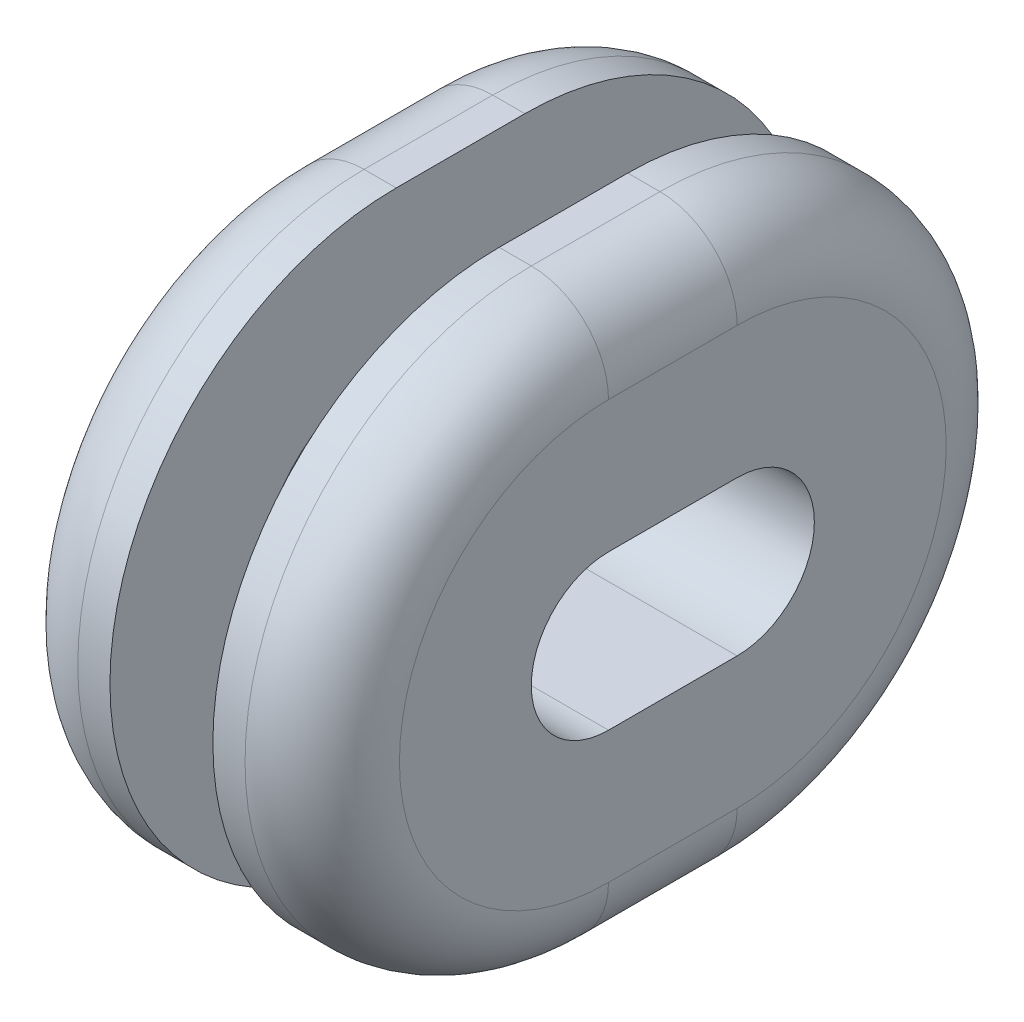
from build123d import *

# Parameters (mm, degrees)
FILLET_1_R = 1.2


with BuildPart() as part:
    # По траектории2: sweep along a path in Эскиз3
    with BuildLine(Plane(origin=(0, 0, 0), x_dir=(0, 0, -1), z_dir=(1, 0, 0))) as sweep_2_path:
        Line((-1, 0), (1, 0))
        ThreePointArc((1, 0), (2.2, -1.2), (1, -2.4))
        Line((1, -2.4), (-1, -2.4))
        ThreePointArc((-1, -2.4), (-2.2, -1.2), (-1, 0))
    # Эскиз1 → По траектории2 (sweep)
    with BuildSketch(Plane.XY):
        Polygon((-0.8, 1), (0.8, 1), (0.8, 3.25), (2.5, 3.25), (2.5, 0), (-2.5, 0), (-2.5, 3.25), (-0.8, 3.25), align=None)
    sweep(path=sweep_2_path.line)

    # Скругление1
    fillet_1_edges = [part.edges().sort_by_distance(p)[0] for p in [
        (2.5, 3.25, 0),
        (-2.5, 3.25, 0),
        (2.5, -1.2, 5.45),
        (-2.5, -1.2, 5.45),
        (2.5, -5.65, 0),
        (-2.5, -5.65, 0),
        (2.5, -1.2, -5.45),
        (-2.5, -1.2, -5.45),
    ]]
    fillet(fillet_1_edges, radius=FILLET_1_R)


solid = part.part
